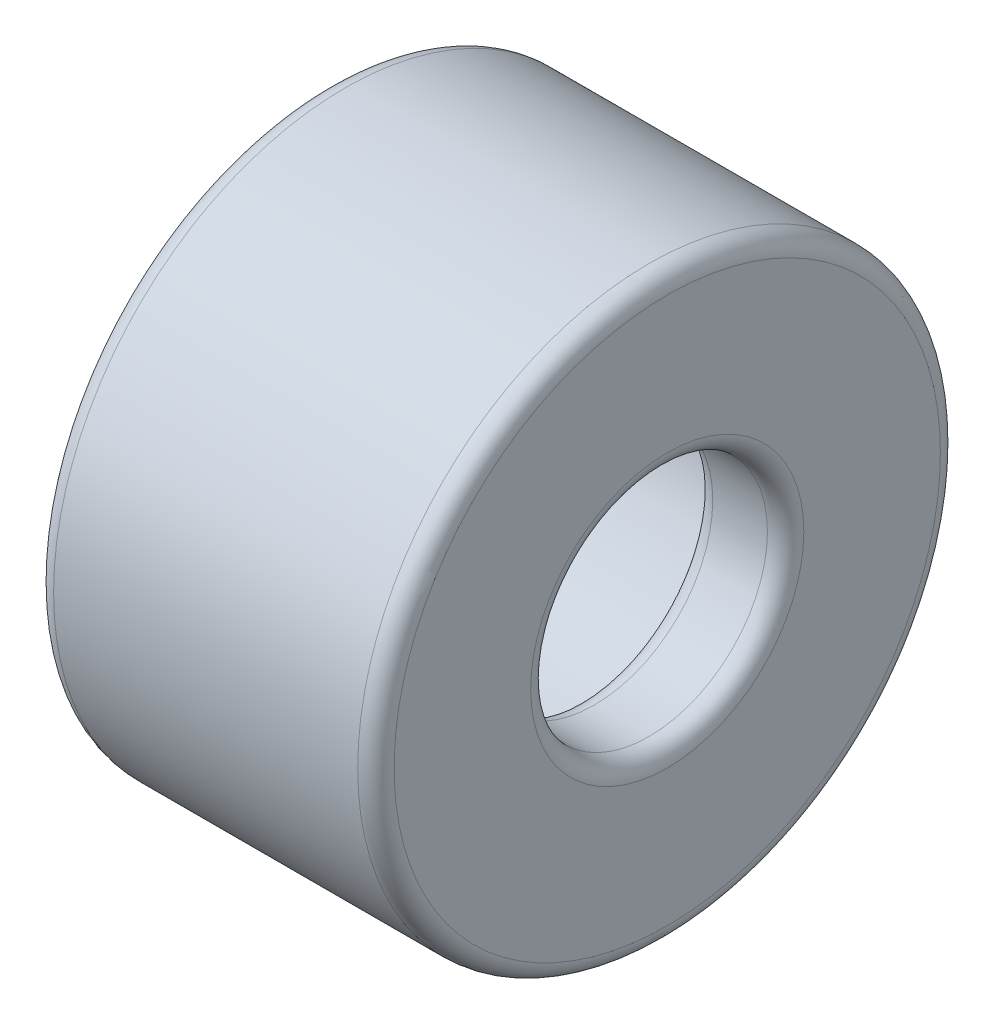
from build123d import *

# Parameters (mm, degrees)
CUT_EXTRUDE1_DEPTH      = 19
CUT_EXTRUDE1_DEPTH_BACK = 19
SKETCH2_R               = 3.25
FILLET1_R               = 0.5


with BuildPart() as part:
    # Sketch1 → Revolve1 (revolve)
    with BuildSketch(Plane.XY, mode=Mode.PRIVATE) as revolve1_sk:
        Polygon((11.5, 5.15), (4.65, 5.15), (4.65, 8), (14, 8), (14, 0), (11.5, 0), align=None)
    revolve(revolve1_sk.sketch.rotate(Axis((-1.174323487, 0, 0), (1, 0, 0)), 90), axis=Axis((-1.174323487, 0, 0), (1, 0, 0)))

    # Sketch2 → Cut-Extrude1 (cut, two sides: drawn at the far end of the back side and taken through both)
    with BuildSketch(Plane(origin=(0, 0, 0), x_dir=(0, 0, -1), z_dir=(1, 0, 0)).offset(-CUT_EXTRUDE1_DEPTH_BACK)):
        with Locations(Location((0, 0, 0), (0, 0, 180))):
            Circle(SKETCH2_R)
    extrude(amount=CUT_EXTRUDE1_DEPTH + CUT_EXTRUDE1_DEPTH_BACK, mode=Mode.SUBTRACT)

    # Fillet1
    fillet1_edges = [part.edges().sort_by_distance(p)[0] for p in [
        (11.5, 0, -3.25),
        (14, 0, -3.25),
        (4.65, 0, -5.15),
        (4.65, 0, -8),
        (14, 0, -8),
    ]]
    fillet(fillet1_edges, radius=FILLET1_R)


solid = part.part
